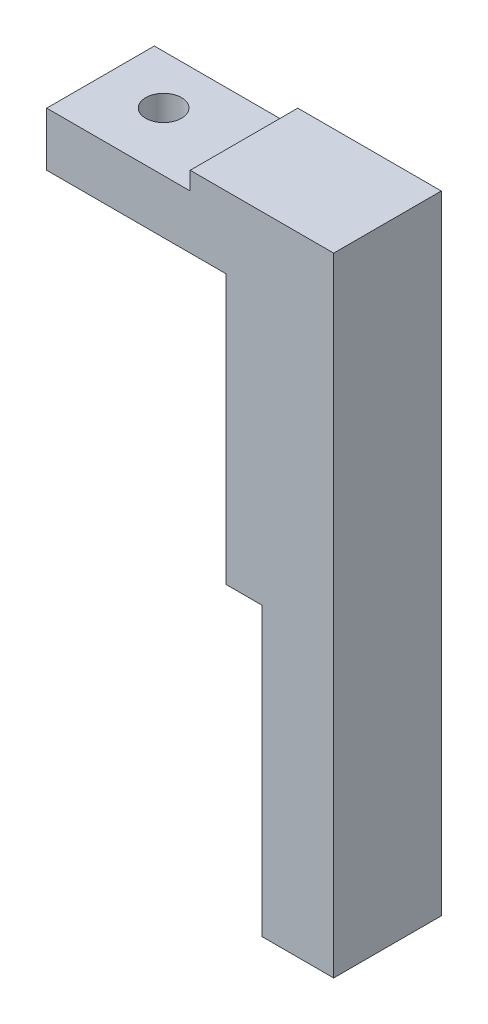
from build123d import *

# Parameters (mm, degrees)
SKETCH1_W           = 15
SKETCH1_H           = 6
BOSS_EXTRUDE1_DEPTH = 3
CUT_EXTRUDE1_REACH  = 18.432
SKETCH2_R           = 1
SKETCH3_W           = 3
SKETCH3_H           = 6
BOSS_EXTRUDE2_DEPTH = 31
SKETCH4_W           = 6
SKETCH4_H           = 34
BOSS_EXTRUDE3_DEPTH = 1
SKETCH5_W           = 8
SKETCH5_H           = 6
BOSS_EXTRUDE4_DEPTH = 1
SKETCH6_W           = 2
SKETCH6_H           = 15
BOSS_EXTRUDE5_DEPTH = 6


with BuildPart() as part:
    # Sketch1 → Boss-Extrude1 (new body)
    with BuildSketch(Plane(origin=(0, 0, 0), x_dir=(1, 0, 0), z_dir=(0, 1, 0))):
        with Locations((7.5, -3)):
            Rectangle(SKETCH1_W, SKETCH1_H)
    extrude(amount=BOSS_EXTRUDE1_DEPTH)

    # Sketch2 → Cut-Extrude1 (cut, up to next)
    with BuildSketch(Plane(origin=(0, 3, 0), x_dir=(1, 0, 0), z_dir=(0, 1, 0)), mode=Mode.PRIVATE) as cut_extrude1_sk1:
        with Locations(Location((3.25, -2.733160164, 0), (0, 0, 270))):
            Circle(SKETCH2_R)
    cut_extrude1_tool1 = extrude(cut_extrude1_sk1.sketch, amount=-CUT_EXTRUDE1_REACH, mode=Mode.PRIVATE) & part.part
    add(cut_extrude1_tool1.solids().sort_by_distance((3.25, 3, 2.73316))[0], mode=Mode.SUBTRACT)

    # Sketch3 → Boss-Extrude2 (add)
    with BuildSketch(Plane.XZ):
        with Locations((13.5, 3)):
            Rectangle(SKETCH3_W, SKETCH3_H)
    extrude(amount=BOSS_EXTRUDE2_DEPTH)

    # Sketch4 → Boss-Extrude3 (add)
    with BuildSketch(Plane(origin=(15, 0, 0), x_dir=(0, 0, -1), z_dir=(1, 0, 0))):
        with Locations((-3, -14)):
            Rectangle(SKETCH4_W, SKETCH4_H)
    extrude(amount=BOSS_EXTRUDE3_DEPTH)

    # Sketch5 → Boss-Extrude4 (add)
    with BuildSketch(Plane(origin=(0, 3, 0), x_dir=(1, 0, 0), z_dir=(0, 1, 0))):
        with Locations((12, -3)):
            Rectangle(SKETCH5_W, SKETCH5_H)
    extrude(amount=BOSS_EXTRUDE4_DEPTH)

    # Sketch6 → Boss-Extrude5 (add)
    with BuildSketch(Plane.XY):
        with Locations((11, -7.5)):
            Rectangle(SKETCH6_W, SKETCH6_H)
    extrude(amount=BOSS_EXTRUDE5_DEPTH)


solid = part.part
